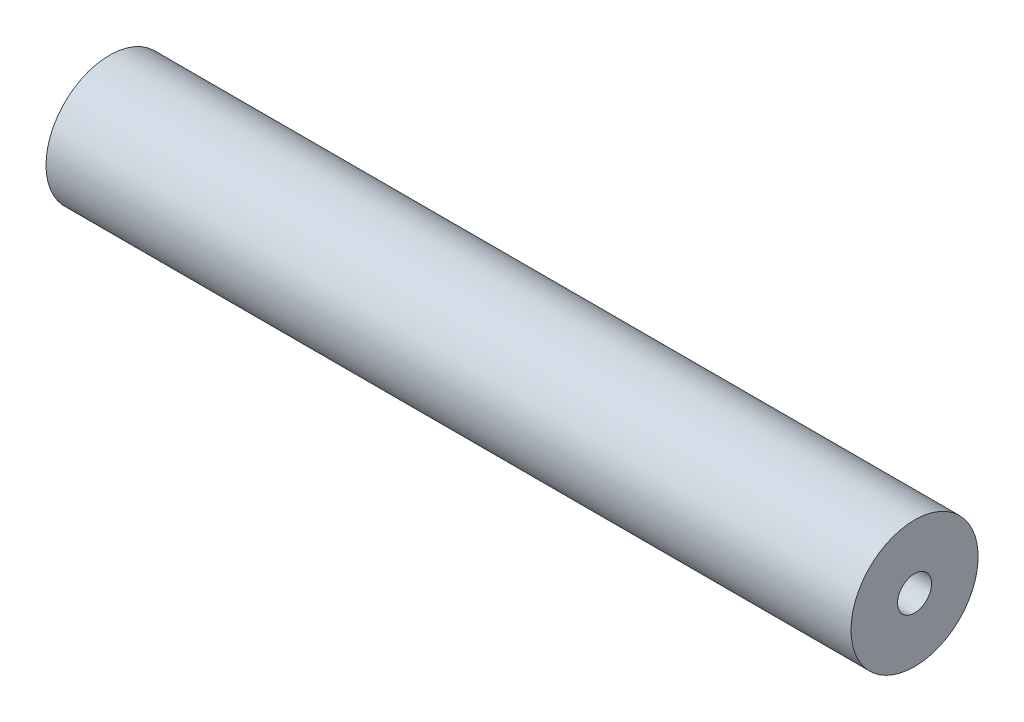
from build123d import *

# Parameters (mm, degrees)
SKETCH1_R                             = 9.525
BOSS_EXTRUDE1_DEPTH                   = 60.325
F_1_4_20_TAPPED_HOLE1_D               = 5.1054
F_1_4_20_TAPPED_HOLE1_DEPTH           = 16.51
F_1_4_20_TAPPED_HOLE1_TIP             = 1.533816902
F_1_4_20_TAPPED_HOLE1_ON_FACE_2_D     = 5.1054
F_1_4_20_TAPPED_HOLE1_ON_FACE_2_DEPTH = 16.51
F_1_4_20_TAPPED_HOLE1_ON_FACE_2_TIP   = 1.533816902


with BuildPart() as part:
    # Sketch1 → Boss-Extrude1 (new, symmetric)
    with BuildSketch(Plane(origin=(0, 0, 0), x_dir=(0, 0, -1), z_dir=(1, 0, 0))):
        with Locations(Location((0, 0, 0), (0, 0, 180))):
            Circle(SKETCH1_R)
    extrude(amount=BOSS_EXTRUDE1_DEPTH, both=True)

    # 1/4-20 Tapped Hole1
    with Locations(Plane(origin=(60.325, 0, 0), x_dir=(0, 0, 1), z_dir=(1, 0, 0))):
        with Locations((0, 0)):
            Hole(F_1_4_20_TAPPED_HOLE1_D / 2, depth=F_1_4_20_TAPPED_HOLE1_DEPTH)
            with Locations((0, 0, -(F_1_4_20_TAPPED_HOLE1_DEPTH + F_1_4_20_TAPPED_HOLE1_TIP / 2))):  # 118° drill point
                Cone(0, F_1_4_20_TAPPED_HOLE1_D / 2, F_1_4_20_TAPPED_HOLE1_TIP, mode=Mode.SUBTRACT)

    # 1/4-20 Tapped Hole1 on face 2
    with Locations(Plane(origin=(-60.325, 0, 0), x_dir=(0, 0, -1), z_dir=(-1, 0, 0))):
        with Locations((0, 0)):
            Hole(F_1_4_20_TAPPED_HOLE1_ON_FACE_2_D / 2, depth=F_1_4_20_TAPPED_HOLE1_ON_FACE_2_DEPTH)
            with Locations((0, 0, -(F_1_4_20_TAPPED_HOLE1_ON_FACE_2_DEPTH + F_1_4_20_TAPPED_HOLE1_ON_FACE_2_TIP / 2))):  # 118° drill point
                Cone(0, F_1_4_20_TAPPED_HOLE1_ON_FACE_2_D / 2, F_1_4_20_TAPPED_HOLE1_ON_FACE_2_TIP, mode=Mode.SUBTRACT)


solid = part.part
